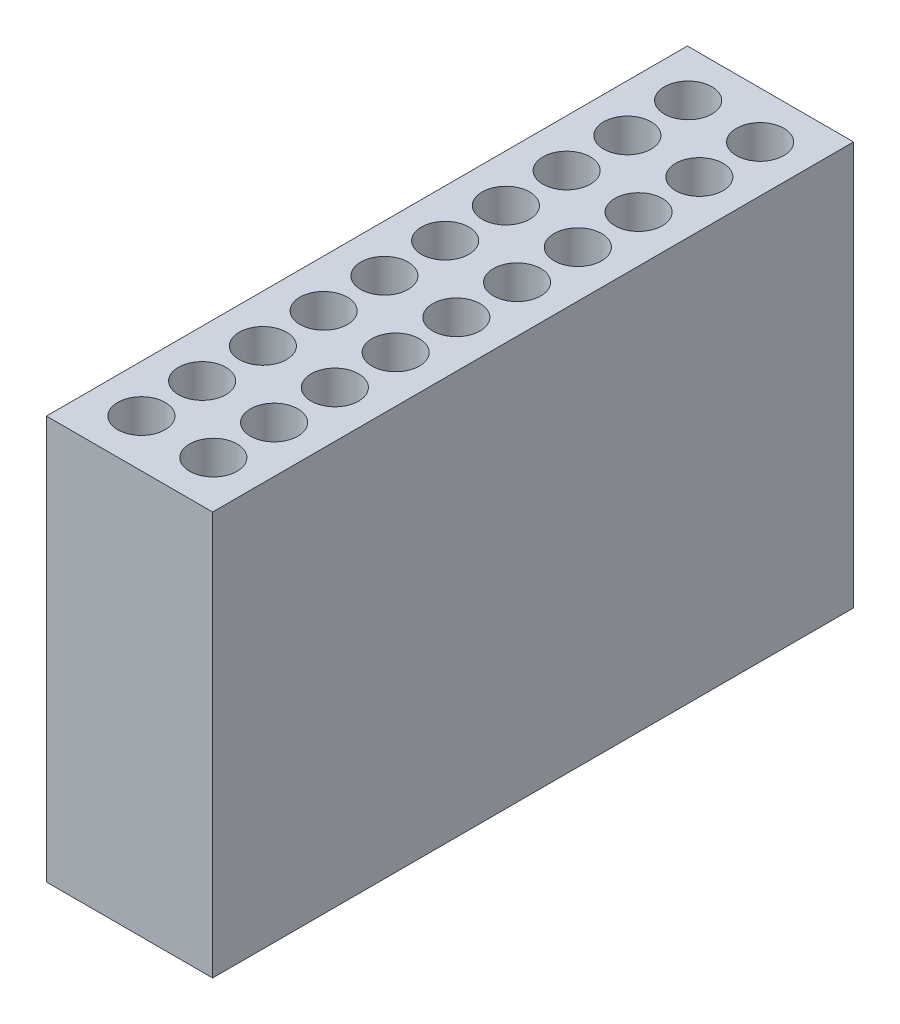
from build123d import *

# Parameters (mm, degrees)
SKETCH1_W            = 1.778
SKETCH1_H            = 6.858
BOSS_EXTRUDE1_DEPTH  = 4.318
SKETCH3_R            = 0.254
CUT_EXTRUDE2_DEPTH   = 6.585112891
LPATTERN2_COUNT      = 10
LPATTERN2_PITCH      = 0.65
LPATTERN2_COUNT_DIR2 = 2
LPATTERN2_PITCH_DIR2 = 0.77


with BuildPart() as part:
    # Sketch1 → Boss-Extrude1 (new body)
    with BuildSketch(Plane(origin=(0, 0, 0), x_dir=(1, 0, 0), z_dir=(0, 1, 0))):
        Rectangle(SKETCH1_W, SKETCH1_H)
    extrude(amount=BOSS_EXTRUDE1_DEPTH)

    # Sketch3 → Cut-Extrude2 (cut, through all)
    with BuildSketch(Plane(origin=(0, 4.318, 0), x_dir=(1, 0, 0), z_dir=(0, 1, 0))):
        with Locations(Location((-0.381, -2.921, 0), (0, 0, 270))):
            Circle(SKETCH3_R)
    cut_extrude2 = extrude(amount=-CUT_EXTRUDE2_DEPTH, mode=Mode.SUBTRACT)

    # LPattern2: Cut-Extrude2 10 × 2
    with Locations(*[(j * LPATTERN2_PITCH_DIR2, 0, -i * LPATTERN2_PITCH) for i in range(LPATTERN2_COUNT) for j in range(LPATTERN2_COUNT_DIR2) if (i, j) != (0, 0)]):
        add(cut_extrude2, mode=Mode.SUBTRACT)


solid = part.part
